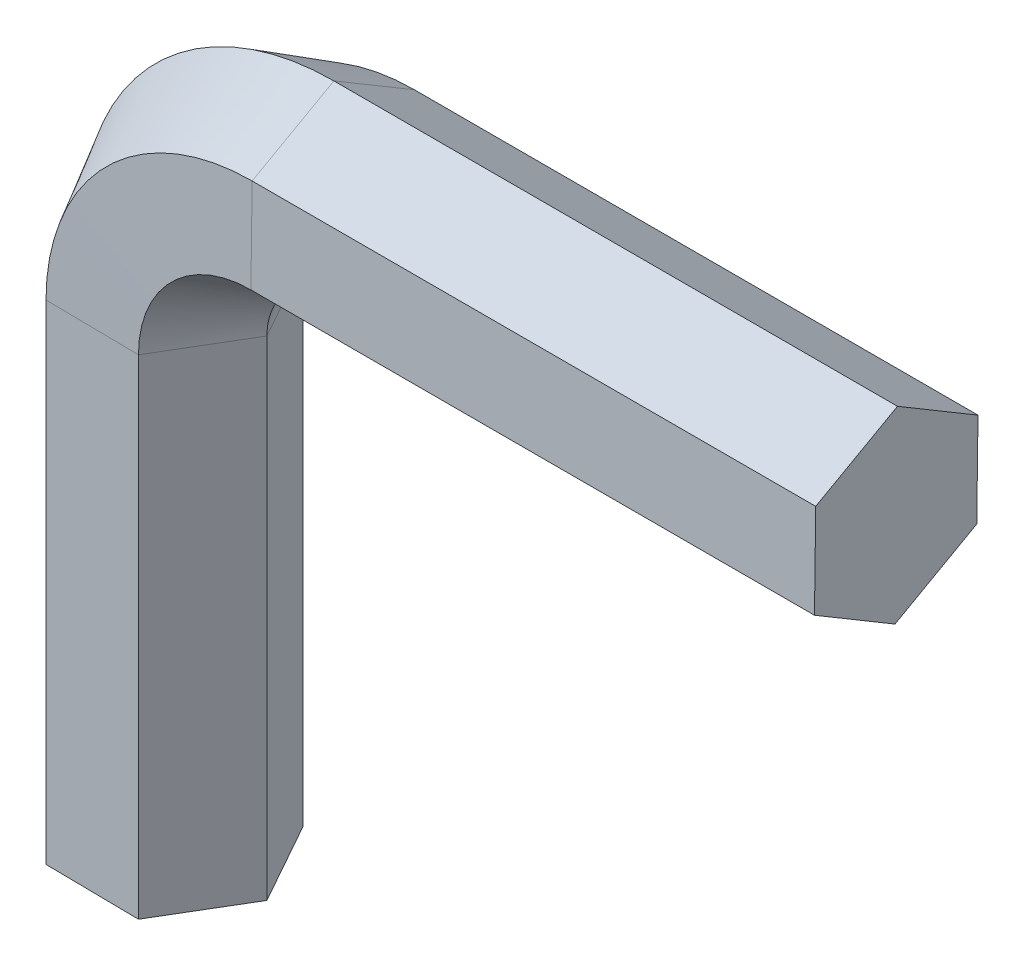
from build123d import *


with BuildPart() as part:
    # 扫描1: sweep along a path in 草图2
    with BuildLine(Plane.XY) as sweep_1_path:
        Line((0, 0), (0, 45.495221089))
        ThreePointArc((0, 45.495221089), (4.31309835, 55.907961623), (14.725838884, 60.221059973))
        Line((14.725838884, 60.221059973), (67.177001903, 60.221059973))
    # 草图3 → 扫描1 (sweep)
    with BuildSketch(Plane(origin=(0, 0, 0), x_dir=(1, 0, 0), z_dir=(0, 1, 0))):
        Polygon((4.259864643, -7.609541104), (8.719988229, -0.115619555), (4.460123586, 7.49392155), (-4.259864643, 7.609541104), (-8.719988229, 0.115619555), (-4.460123586, -7.49392155), align=None)
    sweep(path=sweep_1_path.line)


solid = part.part
